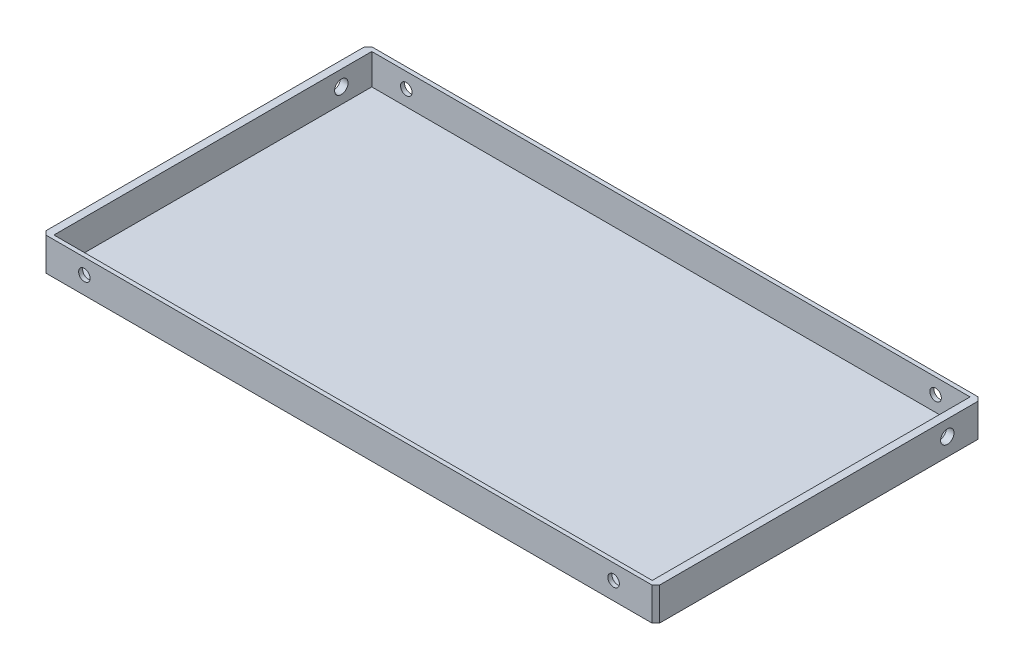
from build123d import *

# Parameters (mm, degrees)
SKETCH1_W           = 160
SKETCH1_H           = 85
BOSS_EXTRUDE1_DEPTH = 0.6
SKETCH2_W           = 160
SKETCH2_H           = 85
SKETCH2_W_2         = 156
SKETCH2_H_2         = 82.875
BOSS_EXTRUDE2_DEPTH = 8
CHAMFER1_SIZE       = 1
SKETCH3_R           = 1.5
CUT_EXTRUDE1_DEPTH  = 98
SKETCH4_R           = 1.75
CUT_EXTRUDE2_DEPTH  = 1000


with BuildPart() as part:
    # Sketch1 → Boss-Extrude1 (new body)
    with BuildSketch(Plane(origin=(0, 0, 0), x_dir=(1, 0, 0), z_dir=(0, 1, 0))):
        Rectangle(SKETCH1_W, SKETCH1_H)
    extrude(amount=BOSS_EXTRUDE1_DEPTH)

    # Sketch2 → Boss-Extrude2 (add)
    with BuildSketch(Plane(origin=(0, 0.6, 0), x_dir=(1, 0, 0), z_dir=(0, 1, 0))):
        Rectangle(SKETCH2_W, SKETCH2_H)
        Rectangle(SKETCH2_W_2, SKETCH2_H_2, mode=Mode.SUBTRACT)
    extrude(amount=BOSS_EXTRUDE2_DEPTH)

    # Chamfer1
    chamfer1_edges = [part.edges().sort_by_distance(p)[0] for p in [
        (80, 4.3, 42.5),
        (-80, 4.3, 42.5),
        (-80, 4.3, -42.5),
        (80, 4.3, -42.5),
    ]]
    chamfer(chamfer1_edges, length=CHAMFER1_SIZE)

    # Sketch3 → Cut-Extrude1 (cut)
    with BuildSketch(Plane.XY.offset(42.5)):
        with Locations((-69, 4.6)):
            Circle(SKETCH3_R)
        with Locations((69, 4.6)):
            Circle(SKETCH3_R)
    extrude(amount=-CUT_EXTRUDE1_DEPTH, mode=Mode.SUBTRACT)

    # Sketch4 → Cut-Extrude2 (cut)
    with BuildSketch(Plane(origin=(80, 0, 0), x_dir=(0, 0, -1), z_dir=(1, 0, 0))):
        with Locations((33.5, 4.6)):
            Circle(SKETCH4_R)
    extrude(amount=-CUT_EXTRUDE2_DEPTH, mode=Mode.SUBTRACT)


solid = part.part
